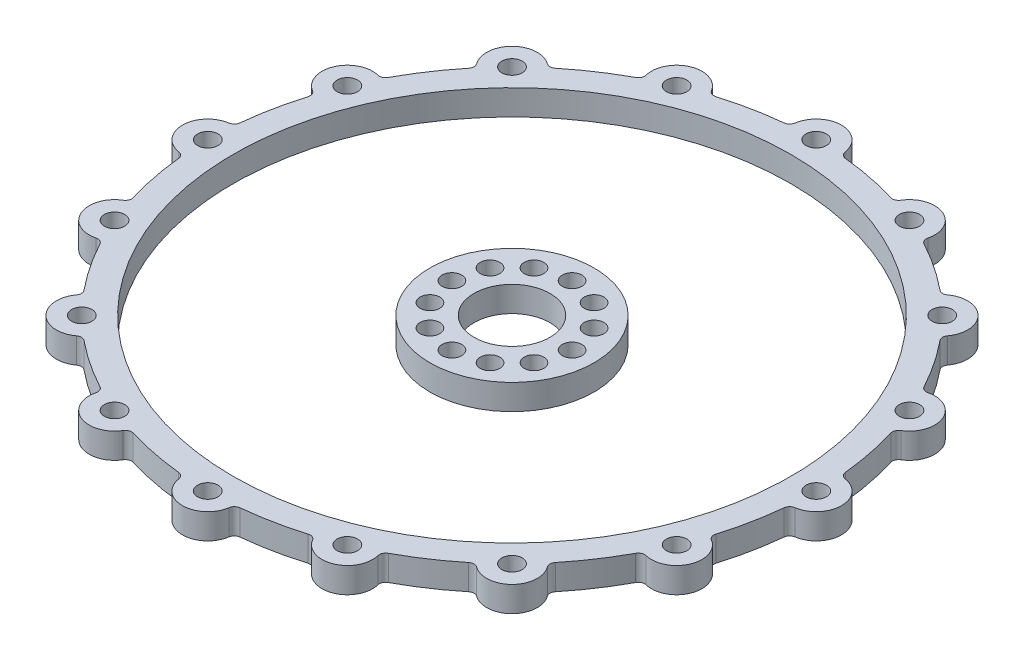
from build123d import *

# Parameters (mm, degrees)
SKETCH1_R                = 76.2
SKETCH1_R_2              = 9.525
BOSS_EXTRUDE1_DEPTH      = 6.35
BOSS_EXTRUDE3_DEPTH      = 6.35
FILLET1_R                = 1.5875
CIRPATTERN1_COUNT        = 16
FILLET1_OF_CIRPATTERN1_R = 1.5875
CIRPATTERN2_COUNT        = 12
SKETCH9_R                = 69.85
SKETCH9_R_2              = 20.574
CUT_EXTRUDE1_DEPTH       = 117.915899408


with BuildPart() as part:
    # Sketch1 → Boss-Extrude1 (new body)
    with BuildSketch(Plane(origin=(0, 0, 0), x_dir=(1, 0, 0), z_dir=(0, 1, 0))):
        with Locations(Location((0, 0, 0), (0, 0, 270))):
            Circle(SKETCH1_R)
        with Locations(Location((0, 0, 0), (0, 0, 270))):
            Circle(SKETCH1_R_2, mode=Mode.SUBTRACT)
    extrude(amount=BOSS_EXTRUDE1_DEPTH)

    # Sketch2 → Boss-Extrude3 (add, through all)
    with BuildSketch(Plane(origin=(0, 6.35, 0), x_dir=(1, 0, 0), z_dir=(0, 1, 0))):
        with BuildLine():
            ThreePointArc((6.344485453, 75.935416667), (0, 76.2), (-6.344485453, 75.935416667))
            ThreePointArc((-6.344485453, 75.935416667), (0, 82.55), (6.344485453, 75.935416667))
        make_face()
    boss_extrude3 = extrude(amount=-BOSS_EXTRUDE3_DEPTH)

    # Fillet1
    fillet1_edges = [part.edges().sort_by_distance(p)[0] for p in [
        (-6.344485453, 3.175, -75.935416667),
        (6.344485453, 3.175, -75.935416667),
    ]]
    fillet(fillet1_edges, radius=FILLET1_R)

    # Sketch5 → #10 Clearance Hole1 (revolve, cut)
    with BuildSketch(Plane(origin=(0, 6.35, -76.2), x_dir=(0, 0, 1), z_dir=(1, 0, 0))):
        Polygon((0, 0), (0, 8.137816902), (2.5527, 6.604), (2.5527, 0), align=None)
    f_10_clearance_hole1 = revolve(axis=Axis((0, 12.7, -76.2), (0, -1, 0)), mode=Mode.SUBTRACT)

    # CirPattern1: Boss-Extrude3, #10 Clearance Hole1 ×16 about axis
    cirpattern1_axis = Axis((0, 0, 0), (0, 1, 0))
    add([boss_extrude3.rotate(cirpattern1_axis, i * 360 / CIRPATTERN1_COUNT) for i in range(1, CIRPATTERN1_COUNT)])
    add([f_10_clearance_hole1.rotate(cirpattern1_axis, i * 360 / CIRPATTERN1_COUNT) for i in range(1, CIRPATTERN1_COUNT)], mode=Mode.SUBTRACT)

    # Fillet1 of CirPattern1
    fillet1_of_cirpattern1_edges = [part.edges().sort_by_distance(p)[0] for p in [
        (-34.920766142, 3.175, -67.727247781),
        (-23.197685634, 3.175, -72.583106721),
        (-58.180676744, 3.175, -49.20821937),
        (-49.20821937, 3.175, -58.180676744),
        (-72.583106721, 3.175, -23.197685634),
        (-67.727247781, 3.175, -34.920766142),
        (-75.935416667, 3.175, 6.344485453),
        (-75.935416667, 3.175, -6.344485453),
        (-67.727247781, 3.175, 34.920766142),
        (-72.583106721, 3.175, 23.197685634),
        (-49.20821937, 3.175, 58.180676744),
        (-58.180676744, 3.175, 49.20821937),
        (-23.197685634, 3.175, 72.583106721),
        (-34.920766142, 3.175, 67.727247781),
        (6.344485453, 3.175, 75.935416667),
        (-6.344485453, 3.175, 75.935416667),
        (34.920766142, 3.175, 67.727247781),
        (23.197685634, 3.175, 72.583106721),
        (58.180676744, 3.175, 49.20821937),
        (49.20821937, 3.175, 58.180676744),
        (72.583106721, 3.175, 23.197685634),
        (67.727247781, 3.175, 34.920766142),
        (75.935416667, 3.175, -6.344485453),
        (75.935416667, 3.175, 6.344485453),
        (67.727247781, 3.175, -34.920766142),
        (72.583106721, 3.175, -23.197685634),
        (49.20821937, 3.175, -58.180676744),
        (58.180676744, 3.175, -49.20821937),
        (23.197685634, 3.175, -72.583106721),
        (34.920766142, 3.175, -67.727247781),
    ]]
    fillet(fillet1_of_cirpattern1_edges, radius=FILLET1_OF_CIRPATTERN1_R)

    # Sketch7 → #10 (0.1935) Diameter Hole1 (revolve, cut)
    with BuildSketch(Plane(origin=(0, 6.35, -15.0495), x_dir=(0, 0, 1), z_dir=(1, 0, 0))):
        Polygon((0, 0), (0, 13.414584928), (2.45745, 11.938), (2.45745, 0), align=None)
    f_10_0_1935_diameter_hole1 = revolve(axis=Axis((0, 12.7, -15.0495), (0, -1, 0)), mode=Mode.SUBTRACT)

    # CirPattern2: #10 (0.1935) Diameter Hole1 ×12 about axis
    cirpattern2_axis = Axis((0, 0, 0), (0, 1, 0))
    for i in range(1, CIRPATTERN2_COUNT):
        add(f_10_0_1935_diameter_hole1.rotate(cirpattern2_axis, i * 360 / CIRPATTERN2_COUNT), mode=Mode.SUBTRACT)

    # Sketch9 → Cut-Extrude1 (cut, through all)
    with BuildSketch(Plane(origin=(0, 6.35, 0), x_dir=(1, 0, 0), z_dir=(0, 1, 0))):
        with Locations(Location((0, 0, 0), (0, 0, 270))):
            Circle(SKETCH9_R)
        with Locations(Location((0, 0, 0), (0, 0, 270))):
            Circle(SKETCH9_R_2, mode=Mode.SUBTRACT)
    extrude(amount=-CUT_EXTRUDE1_DEPTH, mode=Mode.SUBTRACT)


with BuildPart() as cut_extrude1_piece_1:
    # of the separate pieces the step leaves, piece 1, a body of its own (cut_extrude1_pieces)
    add(part.part.solids().sort_by_distance((-36.114058665, 0, -67.098545191))[0])


with BuildPart() as cut_extrude1_piece_2:
    # of the separate pieces the step leaves, piece 2, a body of its own (cut_extrude1_pieces)
    add(part.part.solids().sort_by_distance((0, 0, 20.574))[0])


solid = Compound([cut_extrude1_piece_1.part, cut_extrude1_piece_2.part])
